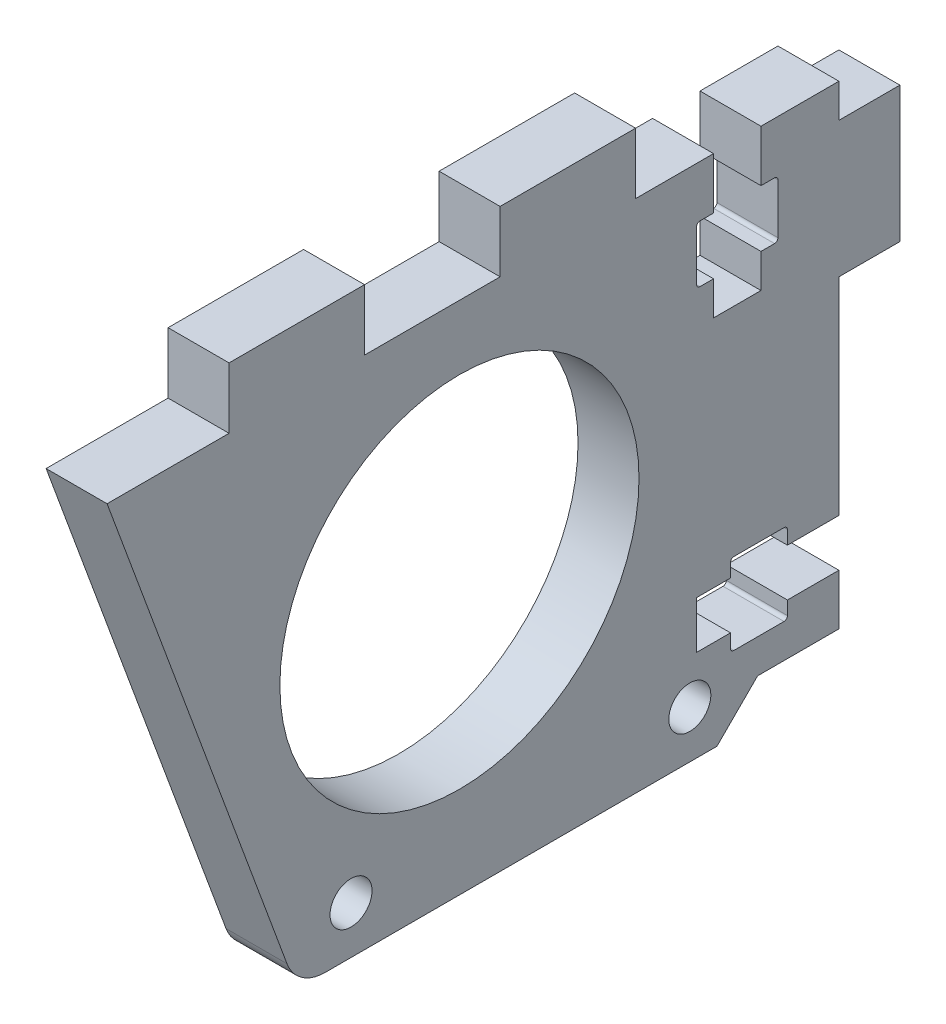
from build123d import *

# Parameters (mm, degrees)
BOSS_EXTRUDE1_DEPTH  = 4.5
SKETCH2_W            = 9
SKETCH2_H            = 10
BOSS_EXTRUDE2_DEPTH  = 4.5
BOSS_EXTRUDE3_DEPTH  = 4.5
CUT_EXTRUDE1_DEPTH   = 65.507751472
SKETCH5_W            = 10
SKETCH5_H            = 4.5
BOSS_EXTRUDE4_DEPTH  = 4.5
CUT_EXTRUDE4_DEPTH   = 65.507751472
BOSS_EXTRUDE11_DEPTH = 4.5
SKETCH21_R           = 1.55
CUT_EXTRUDE8_DEPTH   = 67.183457148
SKETCH22_R           = 13.25
CUT_EXTRUDE9_DEPTH   = 67.183457148


with BuildPart() as part:
    # Sketch1 → Boss-Extrude1 (new body)
    with BuildSketch(Plane(origin=(0, 0, 0), x_dir=(0, 0, -1), z_dir=(1, 0, 0))):
        Polygon((0, 0), (0, -35), (-54, 0), align=None)
    extrude(amount=BOSS_EXTRUDE1_DEPTH)

    # Sketch2 → Boss-Extrude2 (add, through all)
    with BuildSketch(Plane(origin=(4.5, 0, 0), x_dir=(0, 0, -1), z_dir=(1, 0, 0))):
        with Locations((0, -7.5)):
            Rectangle(SKETCH2_W, SKETCH2_H)
    extrude(amount=-BOSS_EXTRUDE2_DEPTH)

    # Sketch3 → Boss-Extrude3 (add, through all)
    with BuildSketch(Plane(origin=(4.5, 0, 0), x_dir=(0, 0, -1), z_dir=(1, 0, 0))):
        Polygon((0, -35), (-15, -35), (-54, 0), (0, -25), align=None)
    extrude(amount=-BOSS_EXTRUDE3_DEPTH)

    # Sketch4 → Cut-Extrude1 (cut, through all)
    with BuildSketch(Plane(origin=(4.5, 0, 0), x_dir=(0, 0, -1), z_dir=(1, 0, 0))):
        with BuildLine():
            Line((0, -31.25), (0, -27.75))
            Line((0, -27.75), (-3.8, -27.75))
            Line((-3.8, -27.75), (-3.8, -26.75))
            ThreePointArc((-3.8, -26.75), (-3.873223305, -26.573223305), (-4.05, -26.5))
            Line((-4.05, -26.5), (-7.75, -26.5))
            ThreePointArc((-7.75, -26.5), (-7.926776695, -26.573223305), (-8, -26.75))
            Line((-8, -26.75), (-8, -27.75))
            Line((-8, -27.75), (-10.5, -27.75))
            Line((-10.5, -27.75), (-10.5, -31.25))
            Line((-10.5, -31.25), (-8, -31.25))
            Line((-8, -31.25), (-8, -32.25))
            ThreePointArc((-8, -32.25), (-7.926776695, -32.426776695), (-7.75, -32.5))
            Line((-7.75, -32.5), (-4.05, -32.5))
            ThreePointArc((-4.05, -32.5), (-3.873223305, -32.426776695), (-3.8, -32.25))
            Line((-3.8, -32.25), (-3.8, -31.25))
            Line((-3.8, -31.25), (0, -31.25))
        make_face()
    extrude(amount=-CUT_EXTRUDE1_DEPTH, mode=Mode.SUBTRACT)

    # Sketch5 → Boss-Extrude4 (add, through all)
    with BuildSketch(Plane(origin=(4.5, 0, 0), x_dir=(0, 0, -1), z_dir=(1, 0, 0))):
        with Locations((-20, 2.25)):
            Rectangle(SKETCH5_W, SKETCH5_H)
        with Locations((-40, 2.25)):
            Rectangle(SKETCH5_W, SKETCH5_H)
    extrude(amount=-BOSS_EXTRUDE4_DEPTH)

    # Sketch11 → Cut-Extrude4 (cut, through all)
    with BuildSketch(Plane.ZY):
        with BuildLine():
            Line((5.75, -10.5), (9.25, -10.5))
            Line((9.25, -10.5), (9.25, -8))
            Line((9.25, -8), (10.25, -8))
            ThreePointArc((10.25, -8), (10.426776695, -7.926776695), (10.5, -7.75))
            Line((10.5, -7.75), (10.5, -4.05))
            ThreePointArc((10.5, -4.05), (10.426776695, -3.873223305), (10.25, -3.8))
            Line((10.25, -3.8), (9.25, -3.8))
            Line((9.25, -3.8), (9.25, 0))
            Line((9.25, 0), (5.75, 0))
            Line((5.75, 0), (5.75, -3.8))
            Line((5.75, -3.8), (4.75, -3.8))
            ThreePointArc((4.75, -3.8), (4.573223305, -3.873223305), (4.5, -4.05))
            Line((4.5, -4.05), (4.5, -7.75))
            ThreePointArc((4.5, -7.75), (4.573223305, -7.926776695), (4.75, -8))
            Line((4.75, -8), (5.75, -8))
            Line((5.75, -8), (5.75, -10.5))
        make_face()
    extrude(amount=-CUT_EXTRUDE4_DEPTH, mode=Mode.SUBTRACT)

    # Sketch20 → Boss-Extrude11 (add, through all)
    with BuildSketch(Plane(origin=(4.5, 0, 0), x_dir=(0, 0, -1), z_dir=(1, 0, 0))):
        with BuildLine():
            Line((-9, -38), (-37.908138411, -38))
            ThreePointArc((-37.908138411, -38), (-39.624042221, -37.460827933), (-40.723167761, -36.037116076))
            Line((-40.723167761, -36.037116076), (-54, 0))
            Line((-54, 0), (-15, -35))
            Line((-15, -35), (-6, -35))
            Line((-6, -35), (-9, -38))
        make_face()
    extrude(amount=-BOSS_EXTRUDE11_DEPTH)

    # Sketch21 → Cut-Extrude8 (cut, through all)
    with BuildSketch(Plane(origin=(4.5, 0, 0), x_dir=(0, 0, -1), z_dir=(1, 0, 0))):
        with Locations((-36, -34.5)):
            Circle(SKETCH21_R)
        with Locations((-11, -34.5)):
            Circle(SKETCH21_R)
    extrude(amount=-CUT_EXTRUDE8_DEPTH, mode=Mode.SUBTRACT)

    # Sketch22 → Cut-Extrude9 (cut, through all)
    with BuildSketch(Plane(origin=(4.5, 0, 0), x_dir=(0, 0, -1), z_dir=(1, 0, 0))):
        with Locations((-28, -18)):
            Circle(SKETCH22_R)
    extrude(amount=-CUT_EXTRUDE9_DEPTH, mode=Mode.SUBTRACT)


solid = part.part
